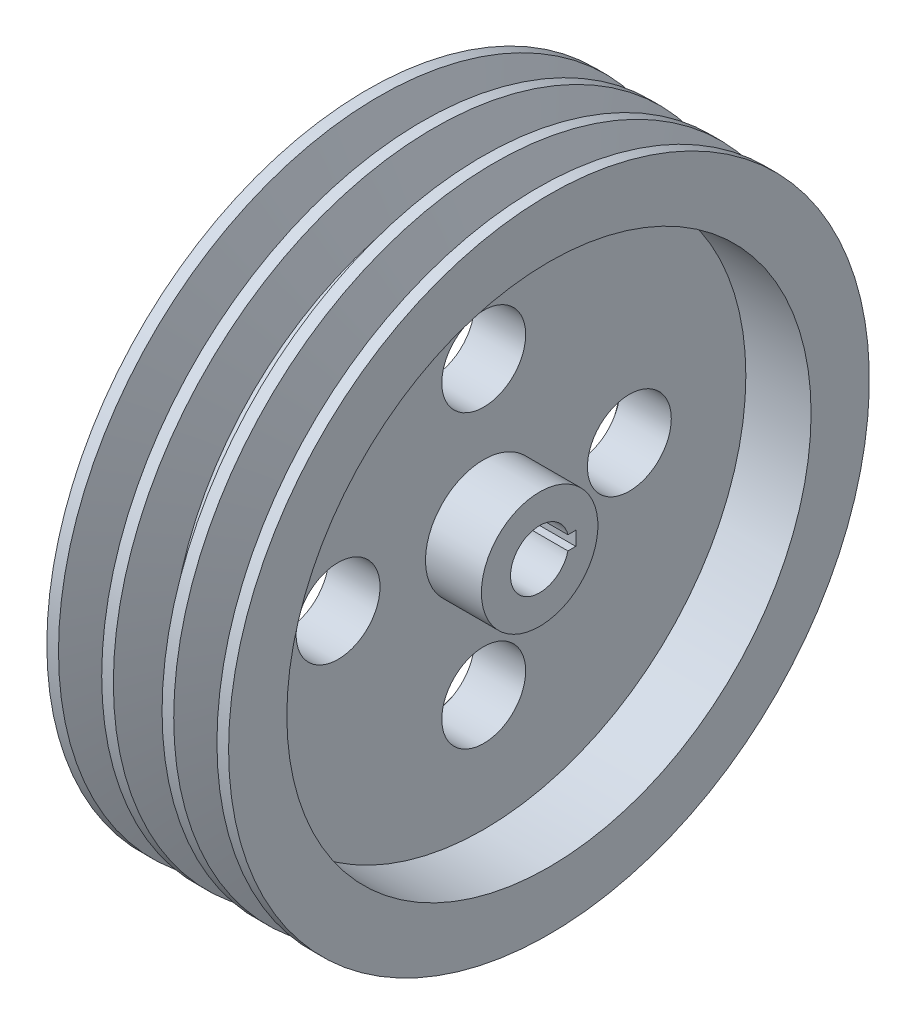
from build123d import *

# Parameters (mm, degrees)
SKETCH3_W           = 3.5
SKETCH3_H           = 6
CUT_EXTRUDE9_DEPTH  = 209.058885895
SKETCH7_R           = 18
CUT_EXTRUDE10_DEPTH = 201.779730053


with BuildPart() as part:
    # Sketch1 → Revolve5 (revolve)
    with BuildSketch(Plane.XY, mode=Mode.PRIVATE) as revolve5_sk:
        Polygon((10.452306897, 137.5), (15.452306897, 137.5), (22.003771114, 119.5), (27.448535783, 119.5), (34, 137.5), (39, 137.5), (39, 112.5), (11, 112.5), (11, 25), (35, 25), (35, 12.5), (-35, 12.5), (-35, 25), (-11, 25), (-11, 112.5), (-39, 112.5), (-39, 137.5), (-34, 137.5), (-27.448535783, 119.5), (-22.003771114, 119.5), (-15.452306897, 137.5), (-10.452306897, 137.5), (-3.900842681, 119.5), (3.900842681, 119.5), align=None)
    revolve(revolve5_sk.sketch.rotate(Axis((-35, 0, 0), (1, 0, 0)), 90), axis=Axis((-35, 0, 0), (1, 0, 0)))

    # Sketch3 → Cut-Extrude9 (cut, through all)
    with BuildSketch(Plane(origin=(35, 0, 0), x_dir=(0, 0, -1), z_dir=(1, 0, 0))):
        with Locations((13.75, 0)):
            Rectangle(SKETCH3_W, SKETCH3_H)
    extrude(amount=-CUT_EXTRUDE9_DEPTH, mode=Mode.SUBTRACT)

    # Sketch7 → Cut-Extrude10 (cut, through all)
    with BuildSketch(Plane(origin=(11, 0, 0), x_dir=(0, 0, -1), z_dir=(1, 0, 0))):
        with Locations((0, 62.5)):
            Circle(SKETCH7_R)
        with Locations((62.5, 0)):
            Circle(SKETCH7_R)
        with Locations((0, -62.5)):
            Circle(SKETCH7_R)
        with Locations((-62.5, 0)):
            Circle(SKETCH7_R)
    extrude(amount=-CUT_EXTRUDE10_DEPTH, mode=Mode.SUBTRACT)


solid = part.part
